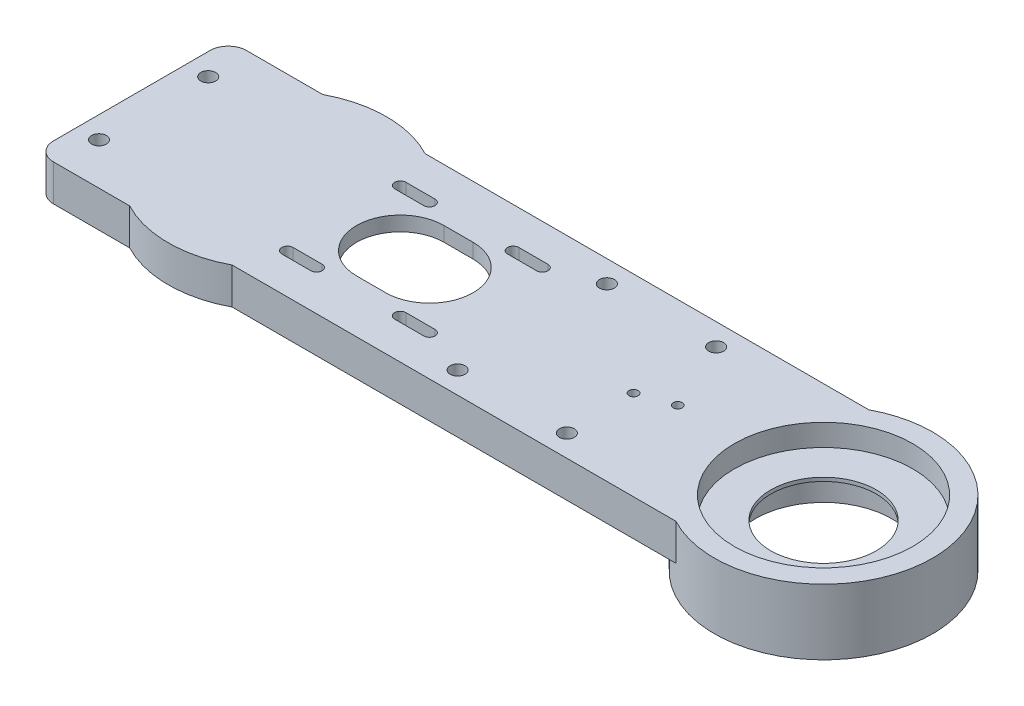
from build123d import *

# Parameters (mm, degrees)
BOSS_EXTRUDE1_DEPTH     = 10
SKETCH2_W               = 50
SKETCH2_H               = 42.5
CUT_EXTRUDE1_DEPTH      = 6
CUT_EXTRUDE7_REACH      = 111.659
SKETCH10_R              = 14.5
CUT_EXTRUDE8_DEPTH      = 110.658560997
CUT_EXTRUDE8_DEPTH_BACK = 3
SKETCH11_R              = 18.75
BOSS_EXTRUDE3_START     = 8
SKETCH12_R              = 30
BOSS_EXTRUDE3_DEPTH     = 8
SKETCH13_R              = 24.5
CUT_EXTRUDE9_DEPTH      = 3
SKETCH14_R              = 18.75
CUT_EXTRUDE10_DEPTH     = 7
CUT_EXTRUDE11_START     = -6
SKETCH15_R              = 24.5
CUT_EXTRUDE11_DEPTH     = 6
CUT_EXTRUDE19_REACH     = 112.095
SKETCH26_W              = 40
SKETCH26_H              = 53
BOSS_EXTRUDE5_DEPTH     = 10
SKETCH19_W              = 46.483409888
SKETCH19_H              = 53
BOSS_EXTRUDE4_DEPTH     = 10
SKETCH23_W              = 7
SKETCH23_H              = 42.47741106
CUT_EXTRUDE18_DEPTH     = 6
FILLET3_R               = 5
SKETCH27_R              = 2.05
SKETCH27_R_2            = 4.962590862
CUT_EXTRUDE20_DEPTH     = 20
CUT_EXTRUDE22_REACH     = 121.269
SKETCH29_R              = 2.05
CUT_EXTRUDE23_REACH     = 121.269
SKETCH30_R              = 1.25


with BuildPart() as part:
    # Sketch1 → Boss-Extrude1 (new body)
    with BuildSketch(Plane(origin=(0, 0, 0), x_dir=(1, 0, 0), z_dir=(0, 1, 0))):
        with BuildLine():
            Line((-52.13627327, 26.5), (60.93763889, 26.5))
            ThreePointArc((60.93763889, 26.5), (105, 0), (60.93763889, -26.5))
            Line((60.93763889, -26.5), (-52.13627327, -26.5))
            Line((-52.13627327, -26.5), (-60.93763889, -26.5))
            ThreePointArc((-60.93763889, -26.5), (-105, 0), (-60.93763889, 26.5))
            Line((-60.93763889, 26.5), (-52.13627327, 26.5))
        make_face()
    extrude(amount=BOSS_EXTRUDE1_DEPTH)

    # Sketch2 → Cut-Extrude1 (cut)
    with BuildSketch(Plane.XZ):
        with Locations((-37.25, 0.02258894)):
            Rectangle(SKETCH2_W, SKETCH2_H)
    extrude(amount=-CUT_EXTRUDE1_DEPTH, mode=Mode.SUBTRACT)

    # Sketch10 → Cut-Extrude7 (cut, up to next)
    with BuildSketch(Plane.XZ, mode=Mode.PRIVATE) as cut_extrude7_sk1:
        with Locations((75, 0)):
            Circle(SKETCH10_R)
    cut_extrude7_tool1 = extrude(cut_extrude7_sk1.sketch, amount=-CUT_EXTRUDE7_REACH, mode=Mode.PRIVATE) & part.part
    add(cut_extrude7_tool1.solids().sort_by_distance((75, 0, 0))[0], mode=Mode.SUBTRACT)

    # Sketch11 → Cut-Extrude8 (cut, two sides: drawn at the far end of the back side and taken through both)
    with BuildSketch(Plane.XZ.offset(-CUT_EXTRUDE8_DEPTH_BACK)):
        with Locations((75, 0)):
            Circle(SKETCH11_R)
    extrude(amount=CUT_EXTRUDE8_DEPTH + CUT_EXTRUDE8_DEPTH_BACK, mode=Mode.SUBTRACT)

    # Sketch12 → Boss-Extrude3 (add)
    with BuildSketch(Plane.XZ.offset(BOSS_EXTRUDE3_START)):
        with Locations((75, 0)):
            Circle(SKETCH12_R)
    extrude(amount=-BOSS_EXTRUDE3_DEPTH)

    # Sketch13 → Cut-Extrude9 (cut)
    with BuildSketch(Plane.XZ.offset(8)):
        with Locations((75, 0)):
            Circle(SKETCH13_R)
    extrude(amount=-CUT_EXTRUDE9_DEPTH, mode=Mode.SUBTRACT)

    # Sketch14 → Cut-Extrude10 (cut)
    with BuildSketch(Plane.XZ.offset(5)):
        with Locations((75, 0)):
            Circle(SKETCH14_R)
    extrude(amount=-CUT_EXTRUDE10_DEPTH, mode=Mode.SUBTRACT)

    # Sketch15 → Cut-Extrude11 (cut)
    with BuildSketch(Plane(origin=(0, 10, 0), x_dir=(1, 0, 0), z_dir=(0, 1, 0)).offset(CUT_EXTRUDE11_START)):
        with Locations((75, 0)):
            Circle(SKETCH15_R)
    extrude(amount=CUT_EXTRUDE11_DEPTH, mode=Mode.SUBTRACT)

    # Sketch25 → Cut-Extrude19 (cut, up to next)
    with BuildSketch(Plane.XZ.offset(-6), mode=Mode.PRIVATE) as cut_extrude19_sk1:
        with BuildLine():
            Line((-33.25, -12), (-41.25, -12))
            ThreePointArc((-41.25, -12), (-53.25, 0), (-41.25, 12))
            Line((-41.25, 12), (-33.25, 12))
            ThreePointArc((-33.25, 12), (-21.25, 0), (-33.25, -12))
        make_face()
    cut_extrude19_tool1 = extrude(cut_extrude19_sk1.sketch, amount=-CUT_EXTRUDE19_REACH, mode=Mode.PRIVATE) & part.part
    # Sketch25 → Cut-Extrude19 (cut, up to next)
    with BuildSketch(Plane.XZ.offset(-6), mode=Mode.PRIVATE) as cut_extrude19_sk2:
        with BuildLine():
            Line((-17.75, -17.05), (-25.75, -17.05))
            ThreePointArc((-25.75, -17.05), (-27.3, -15.5), (-25.75, -13.95))
            Line((-25.75, -13.95), (-17.75, -13.95))
            ThreePointArc((-17.75, -13.95), (-16.2, -15.5), (-17.75, -17.05))
        make_face()
    cut_extrude19_tool2 = extrude(cut_extrude19_sk2.sketch, amount=-CUT_EXTRUDE19_REACH, mode=Mode.PRIVATE) & part.part
    # Sketch25 → Cut-Extrude19 (cut, up to next)
    with BuildSketch(Plane.XZ.offset(-6), mode=Mode.PRIVATE) as cut_extrude19_sk3:
        with BuildLine():
            Line((-48.75, -17.05), (-56.75, -17.05))
            ThreePointArc((-56.75, -17.05), (-58.3, -15.5), (-56.75, -13.95))
            Line((-56.75, -13.95), (-48.75, -13.95))
            ThreePointArc((-48.75, -13.95), (-47.2, -15.5), (-48.75, -17.05))
        make_face()
    cut_extrude19_tool3 = extrude(cut_extrude19_sk3.sketch, amount=-CUT_EXTRUDE19_REACH, mode=Mode.PRIVATE) & part.part
    # Sketch25 → Cut-Extrude19 (cut, up to next)
    with BuildSketch(Plane.XZ.offset(-6), mode=Mode.PRIVATE) as cut_extrude19_sk4:
        with BuildLine():
            Line((-48.75, 13.95), (-56.75, 13.95))
            ThreePointArc((-56.75, 13.95), (-58.3, 15.5), (-56.75, 17.05))
            Line((-56.75, 17.05), (-48.75, 17.05))
            ThreePointArc((-48.75, 17.05), (-47.2, 15.5), (-48.75, 13.95))
        make_face()
    cut_extrude19_tool4 = extrude(cut_extrude19_sk4.sketch, amount=-CUT_EXTRUDE19_REACH, mode=Mode.PRIVATE) & part.part
    # Sketch25 → Cut-Extrude19 (cut, up to next)
    with BuildSketch(Plane.XZ.offset(-6), mode=Mode.PRIVATE) as cut_extrude19_sk5:
        with BuildLine():
            Line((-17.75, 13.95), (-25.75, 13.95))
            ThreePointArc((-25.75, 13.95), (-27.3, 15.5), (-25.75, 17.05))
            Line((-25.75, 17.05), (-17.75, 17.05))
            ThreePointArc((-17.75, 17.05), (-16.2, 15.5), (-17.75, 13.95))
        make_face()
    cut_extrude19_tool5 = extrude(cut_extrude19_sk5.sketch, amount=-CUT_EXTRUDE19_REACH, mode=Mode.PRIVATE) & part.part
    add(cut_extrude19_tool1.solids().sort_by_distance((-37.25, 6, 0))[0], mode=Mode.SUBTRACT)
    add(cut_extrude19_tool2.solids().sort_by_distance((-21.75, 6, -15.5))[0], mode=Mode.SUBTRACT)
    add(cut_extrude19_tool3.solids().sort_by_distance((-52.75, 6, -15.5))[0], mode=Mode.SUBTRACT)
    add(cut_extrude19_tool4.solids().sort_by_distance((-52.75, 6, 15.5))[0], mode=Mode.SUBTRACT)
    add(cut_extrude19_tool5.solids().sort_by_distance((-21.75, 6, 15.5))[0], mode=Mode.SUBTRACT)

    # Sketch26 → Boss-Extrude5 (add)
    with BuildSketch(Plane(origin=(0, 10, 0), x_dir=(1, 0, 0), z_dir=(0, 1, 0))):
        with Locations((-95, 0)):
            Rectangle(SKETCH26_W, SKETCH26_H)
    extrude(amount=-BOSS_EXTRUDE5_DEPTH)

    # Sketch19 → Boss-Extrude4 (add)
    with BuildSketch(Plane(origin=(0, 10, 0), x_dir=(1, 0, 0), z_dir=(0, 1, 0))):
        with Locations((-91.758295056, 0)):
            Rectangle(SKETCH19_W, SKETCH19_H)
    extrude(amount=-BOSS_EXTRUDE4_DEPTH)

    # Sketch23 → Cut-Extrude18 (cut)
    with BuildSketch(Plane.XZ):
        with Locations((-65.75, 0.01129447)):
            Rectangle(SKETCH23_W, SKETCH23_H)
    extrude(amount=-CUT_EXTRUDE18_DEPTH, mode=Mode.SUBTRACT)

    # Fillet3
    fillet3_edges = [part.edges().sort_by_distance(p)[0] for p in [
        (-115, 5, 26.5),
        (-115, 5, -26.5),
    ]]
    fillet(fillet3_edges, radius=FILLET3_R)

    # Sketch27 → Cut-Extrude20 (cut)
    with BuildSketch(Plane(origin=(0, 10, 0), x_dir=(1, 0, 0), z_dir=(0, 1, 0))):
        with Locations((25, -20.5)):
            Circle(SKETCH27_R)
        with Locations((-5, -20.5)):
            Circle(SKETCH27_R)
        with Locations((75, 0)):
            Circle(SKETCH27_R_2)
    cut_extrude20 = extrude(amount=-CUT_EXTRUDE20_DEPTH, mode=Mode.SUBTRACT)

    # Sketch29 → Cut-Extrude22 (cut, up to next)
    with BuildSketch(Plane.XZ, mode=Mode.PRIVATE) as cut_extrude22_sk1:
        with Locations((-109, -15)):
            Circle(SKETCH29_R)
    cut_extrude22_tool1 = extrude(cut_extrude22_sk1.sketch, amount=-CUT_EXTRUDE22_REACH, mode=Mode.PRIVATE) & part.part
    # Sketch29 → Cut-Extrude22 (cut, up to next)
    with BuildSketch(Plane.XZ, mode=Mode.PRIVATE) as cut_extrude22_sk2:
        with Locations((-109, 15)):
            Circle(SKETCH29_R)
    cut_extrude22_tool2 = extrude(cut_extrude22_sk2.sketch, amount=-CUT_EXTRUDE22_REACH, mode=Mode.PRIVATE) & part.part
    add(cut_extrude22_tool1.solids().sort_by_distance((-109, 0, -15))[0], mode=Mode.SUBTRACT)
    add(cut_extrude22_tool2.solids().sort_by_distance((-109, 0, 15))[0], mode=Mode.SUBTRACT)

    # Mirror2: Cut-Extrude20 across plane
    add(cut_extrude20.mirror(Plane.XY), mode=Mode.SUBTRACT)

    # Sketch30 → Cut-Extrude23 (cut, up to next)
    with BuildSketch(Plane.XZ, mode=Mode.PRIVATE) as cut_extrude23_sk1:
        with Locations((24.664028051, 1.845213245)):
            Circle(SKETCH30_R)
    cut_extrude23_tool1 = extrude(cut_extrude23_sk1.sketch, amount=-CUT_EXTRUDE23_REACH, mode=Mode.PRIVATE) & part.part
    # Sketch30 → Cut-Extrude23 (cut, up to next)
    with BuildSketch(Plane.XZ, mode=Mode.PRIVATE) as cut_extrude23_sk2:
        with Locations((33.61486353, -1.337952512)):
            Circle(SKETCH30_R)
    cut_extrude23_tool2 = extrude(cut_extrude23_sk2.sketch, amount=-CUT_EXTRUDE23_REACH, mode=Mode.PRIVATE) & part.part
    add(cut_extrude23_tool1.solids().sort_by_distance((24.664028, 0, 1.845213))[0], mode=Mode.SUBTRACT)
    add(cut_extrude23_tool2.solids().sort_by_distance((33.614864, 0, -1.337953))[0], mode=Mode.SUBTRACT)


solid = part.part
